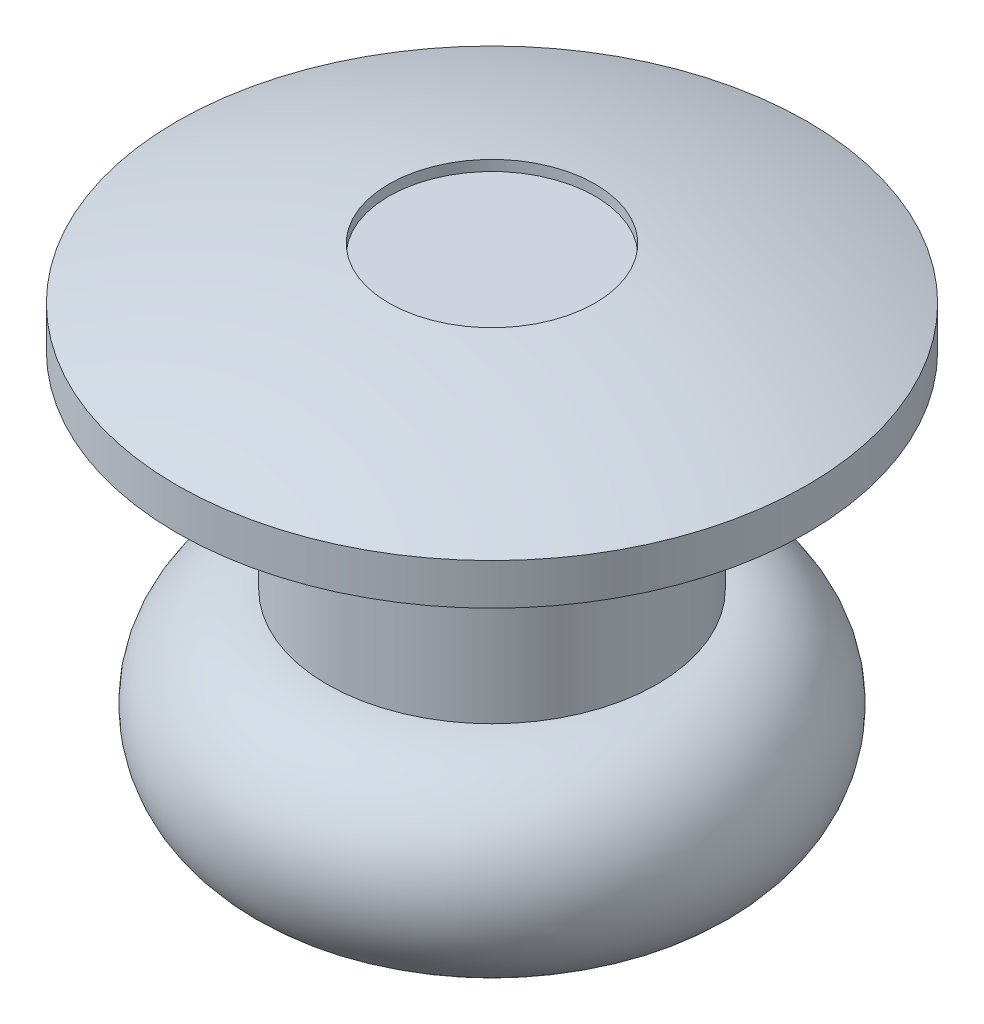
from build123d import *


with BuildPart() as part:
    # Эскиз1 → Повернуть1 (revolve)
    with BuildSketch(Plane.XY, mode=Mode.PRIVATE) as revolve_1_sk:
        with BuildLine():
            Line((3.82, -1.2), (2, -1.2))
            Line((2, -1.2), (2, -3.7))
            ThreePointArc((2, -3.7), (3.2, -4.9), (2, -6.1))
            Line((2, -6.1), (0, -6.1))
            Line((0, -6.1), (0, -0.2))
            Line((0, -0.2), (1.25, -0.2))
            Line((1.25, -0.2), (1.25, -0.072764031))
            ThreePointArc((1.25, -0.072764031), (2.554325985, -0.307196852), (3.82, -0.7))
            Line((3.82, -0.7), (3.82, -1.2))
        make_face()
    revolve(revolve_1_sk.sketch.rotate(Axis((0, -0.2, 0), (0, -1, 0)), 180), axis=Axis((0, -0.2, 0), (0, -1, 0)))


solid = part.part
